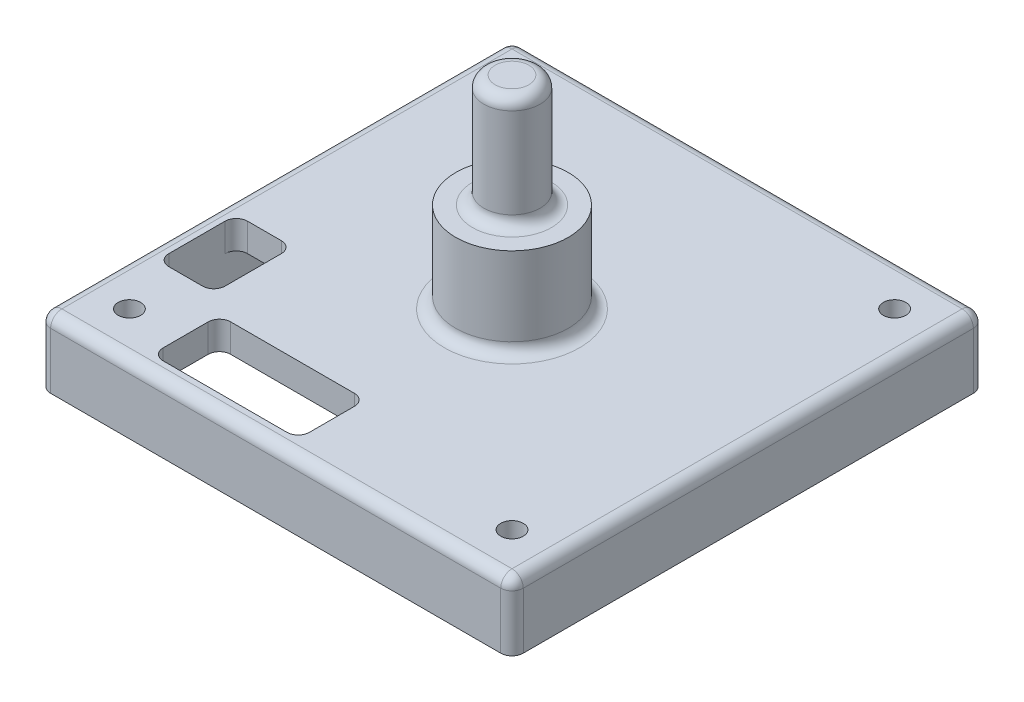
from build123d import *

# Parameters (mm, degrees)
SKETCH1_W           = 42
SKETCH1_H           = 42
BOSS_EXTRUDE1_DEPTH = 6
SKETCH2_W           = 39
SKETCH2_H           = 39
CUT_EXTRUDE1_DEPTH  = 3.5
CUT_EXTRUDE2_REACH  = 31.904
SKETCH3_W           = 5
SKETCH3_H           = 7
SKETCH3_W_2         = 13
SKETCH3_H_2         = 6
BOSS_EXTRUDE2_DEPTH = 2
SKETCH5_R           = 1
CUT_EXTRUDE3_DEPTH  = 31.037476592
SKETCH6_R           = 5
BOSS_EXTRUDE3_DEPTH = 8
SKETCH7_R           = 2.5
BOSS_EXTRUDE4_DEPTH = 10
FILLET1_R           = 1


with BuildPart() as part:
    # Sketch1 → Boss-Extrude1 (new body)
    with BuildSketch(Plane(origin=(0, 0, 0), x_dir=(1, 0, 0), z_dir=(0, 1, 0))):
        Rectangle(SKETCH1_W, SKETCH1_H)
    extrude(amount=BOSS_EXTRUDE1_DEPTH)

    # Sketch2 → Cut-Extrude1 (cut)
    with BuildSketch(Plane.XZ):
        Rectangle(SKETCH2_W, SKETCH2_H)
    extrude(amount=-CUT_EXTRUDE1_DEPTH, mode=Mode.SUBTRACT)

    # Sketch3 → Cut-Extrude2 (cut, up to next)
    with BuildSketch(Plane.XZ.offset(-3.5), mode=Mode.PRIVATE) as cut_extrude2_sk1:
        with Locations((-17, 8.5)):
            Rectangle(SKETCH3_W, SKETCH3_H)
    cut_extrude2_tool1 = extrude(cut_extrude2_sk1.sketch, amount=-CUT_EXTRUDE2_REACH, mode=Mode.PRIVATE) & part.part
    # Sketch3 → Cut-Extrude2 (cut, up to next)
    with BuildSketch(Plane.XZ.offset(-3.5), mode=Mode.PRIVATE) as cut_extrude2_sk2:
        with Locations((-6, 16.5)):
            Rectangle(SKETCH3_W_2, SKETCH3_H_2)
    cut_extrude2_tool2 = extrude(cut_extrude2_sk2.sketch, amount=-CUT_EXTRUDE2_REACH, mode=Mode.PRIVATE) & part.part
    add(cut_extrude2_tool1.solids().sort_by_distance((-17, 3.5, 8.5))[0], mode=Mode.SUBTRACT)
    add(cut_extrude2_tool2.solids().sort_by_distance((-6, 3.5, 16.5))[0], mode=Mode.SUBTRACT)

    # Sketch4 → Boss-Extrude2 (add)
    with BuildSketch(Plane.XZ.offset(-3.5)):
        with BuildLine():
            Line((-19.5, 17), (-19.5, 19.5))
            Line((-19.5, 19.5), (-17, 19.5))
            ThreePointArc((-17, 19.5), (-15.232233047, 15.232233047), (-19.5, 17))
        make_face()
        with BuildLine():
            Line((19.5, 19.5), (17, 19.5))
            ThreePointArc((17, 19.5), (15.232233047, 15.232233047), (19.5, 17))
            Line((19.5, 17), (19.5, 19.5))
        make_face()
        with BuildLine():
            Line((-19.5, -19.5), (-17, -19.5))
            ThreePointArc((-17, -19.5), (-15.232233047, -15.232233047), (-19.5, -17))
            Line((-19.5, -17), (-19.5, -19.5))
        make_face()
        with BuildLine():
            Line((19.5, -17), (19.5, -19.5))
            Line((19.5, -19.5), (17, -19.5))
            ThreePointArc((17, -19.5), (15.232233047, -15.232233047), (19.5, -17))
        make_face()
    extrude(amount=BOSS_EXTRUDE2_DEPTH)

    # Sketch5 → Cut-Extrude3 (cut, through all)
    with BuildSketch(Plane.XZ.offset(-1.5)):
        with Locations(Location((-17, 17, 0), (0, 0, 270))):
            Circle(SKETCH5_R)
        with Locations(Location((17, 17, 0), (0, 0, 270))):
            Circle(SKETCH5_R)
        with Locations(Location((17, -17, 0), (0, 0, 270))):
            Circle(SKETCH5_R)
        with Locations(Location((-17, -17, 0), (0, 0, 270))):
            Circle(SKETCH5_R)
    extrude(amount=-CUT_EXTRUDE3_DEPTH, mode=Mode.SUBTRACT)

    # Sketch6 → Boss-Extrude3 (add)
    with BuildSketch(Plane(origin=(0, 6, 0), x_dir=(1, 0, 0), z_dir=(0, 1, 0))):
        with Locations(Location((0, 0, 0), (0, 0, 270))):
            Circle(SKETCH6_R)
    extrude(amount=BOSS_EXTRUDE3_DEPTH)

    # Sketch7 → Boss-Extrude4 (add)
    with BuildSketch(Plane(origin=(0, 14, 0), x_dir=(1, 0, 0), z_dir=(0, 1, 0))):
        with Locations(Location((0, 0, 0), (0, 0, 270))):
            Circle(SKETCH7_R)
    extrude(amount=BOSS_EXTRUDE4_DEPTH)

    # Fillet1
    fillet1_edges = [part.edges().sort_by_distance(p)[0] for p in [
        (0, 6, -5),
        (0, 14, -2.5),
        (0, 24, -2.5),
        (-21, 6, 0),
        (0, 6, 21),
        (-14.5, 4.75, 12),
        (-14.5, 4.75, 5),
        (-19.5, 4.75, 5),
        (-19.5, 4.75, 12),
        (0.5, 4.75, 19.5),
        (0.5, 4.75, 13.5),
        (-12.5, 4.75, 13.5),
        (-12.5, 4.75, 19.5),
        (21, 6, 0),
        (21, 3, 21),
        (-21, 3, 21),
        (-21, 3, -21),
        (21, 3, -21),
        (0, 6, -21),
    ]]
    fillet(fillet1_edges, radius=FILLET1_R)


solid = part.part
